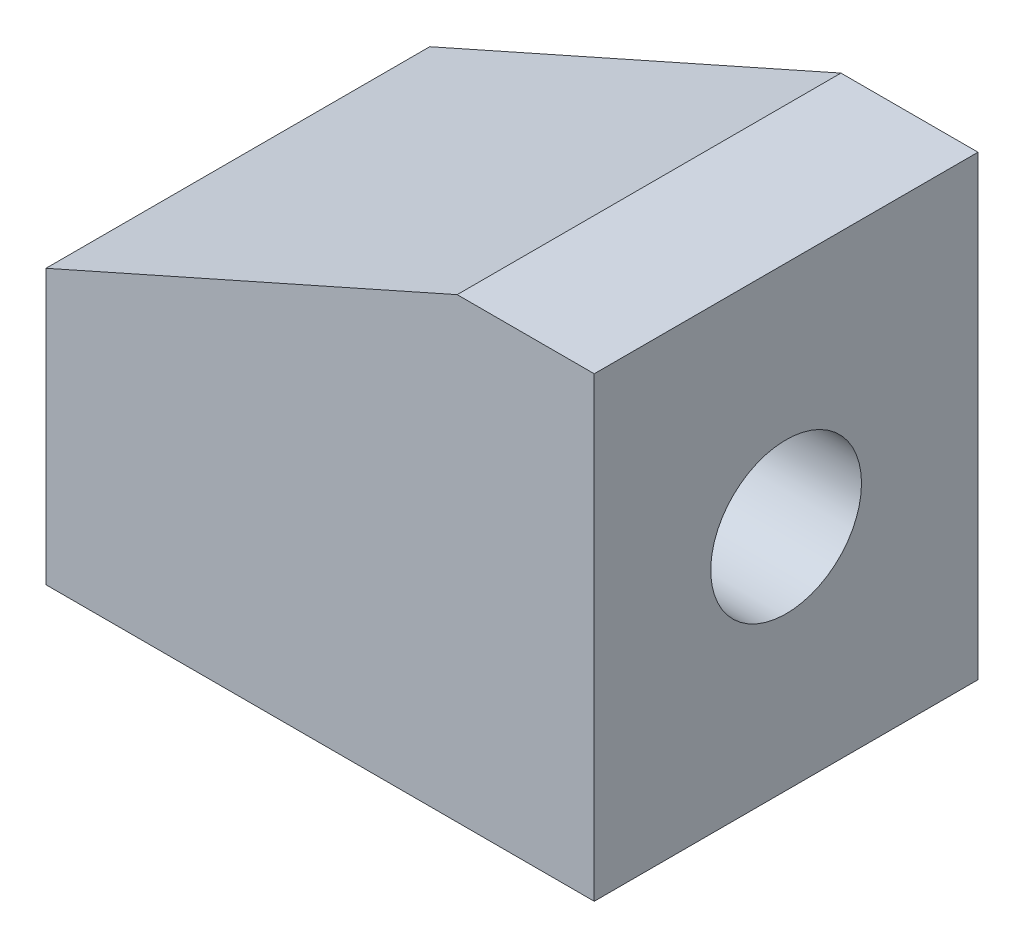
from build123d import *

# Parameters (mm, degrees)
BOSS_EXTRUDE1_DEPTH        = 42
M18X1_5_TAPPED_HOLE1_D     = 16.5
M18X1_5_TAPPED_HOLE1_DEPTH = 43.5
M18X1_5_TAPPED_HOLE1_TIP   = 4.957100107


with BuildPart() as part:
    # Sketch1 → Boss-Extrude1 (new body)
    with BuildSketch(Plane.XY):
        Polygon((-30, 15), (15, 35), (30, 35), (30, -15), (-30, -15), align=None)
    extrude(amount=BOSS_EXTRUDE1_DEPTH)

    # M18x1.5 Tapped Hole1
    with Locations(Plane(origin=(30, 10, 21), x_dir=(0, 1, 0), z_dir=(1, 0, 0))):
        with Locations((0, 0)):
            Hole(M18X1_5_TAPPED_HOLE1_D / 2, depth=M18X1_5_TAPPED_HOLE1_DEPTH)
            with Locations((0, 0, -(M18X1_5_TAPPED_HOLE1_DEPTH + M18X1_5_TAPPED_HOLE1_TIP / 2))):  # 118° drill point
                Cone(0, M18X1_5_TAPPED_HOLE1_D / 2, M18X1_5_TAPPED_HOLE1_TIP, mode=Mode.SUBTRACT)


solid = part.part
